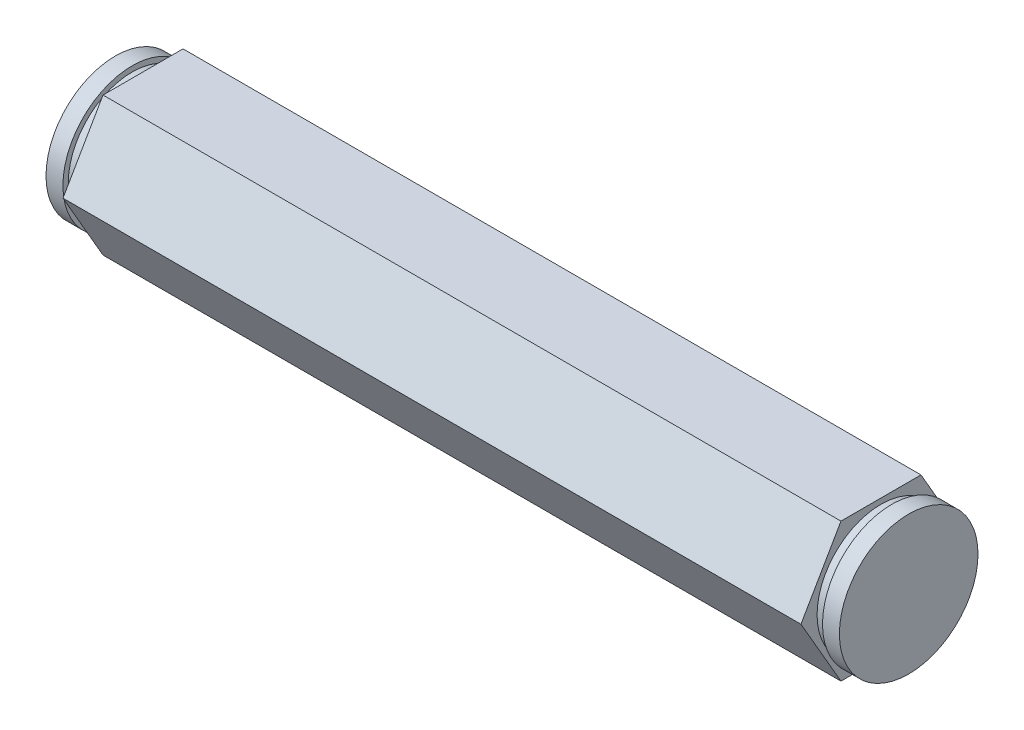
from build123d import *

# Parameters (mm, degrees)
BOSS_EXTRUDE1_DEPTH = 36.34875001


with BuildPart() as part:
    # Sketch1 → Boss-Extrude1 (new, symmetric)
    with BuildSketch(Plane(origin=(0, 0, 0), x_dir=(0, 0, -1), z_dir=(1, 0, 0))):
        Polygon((7.332348419, 0), (3.666174209, 6.35), (-3.666174209, 6.35), (-7.332348419, 0), (-3.666174209, -6.35), (3.666174209, -6.35), align=None)
    extrude(amount=BOSS_EXTRUDE1_DEPTH, both=True)

    # Sketch2 → Cut-Revolve1 (revolve, cut)
    with BuildSketch(Plane(origin=(0, 0, 0), x_dir=(1, 0, 0), z_dir=(0, 1, 0))):
        Polygon((33.80875001, -5.8547), (34.79935001, -5.8547), (34.79935001, -6.35), (36.34875001, -6.35), (36.34875001, -8.89), (33.80875001, -8.89), align=None)
    cut_revolve1 = revolve(axis=Axis((0, 0, 0), (1, 0, 0)), mode=Mode.SUBTRACT)

    # Mirror1: Cut-Revolve1 across plane
    add(cut_revolve1.mirror(Plane(origin=(0, 0, 0), x_dir=(0, 0, 1), z_dir=(1, 0, 0))), mode=Mode.SUBTRACT)


solid = part.part
